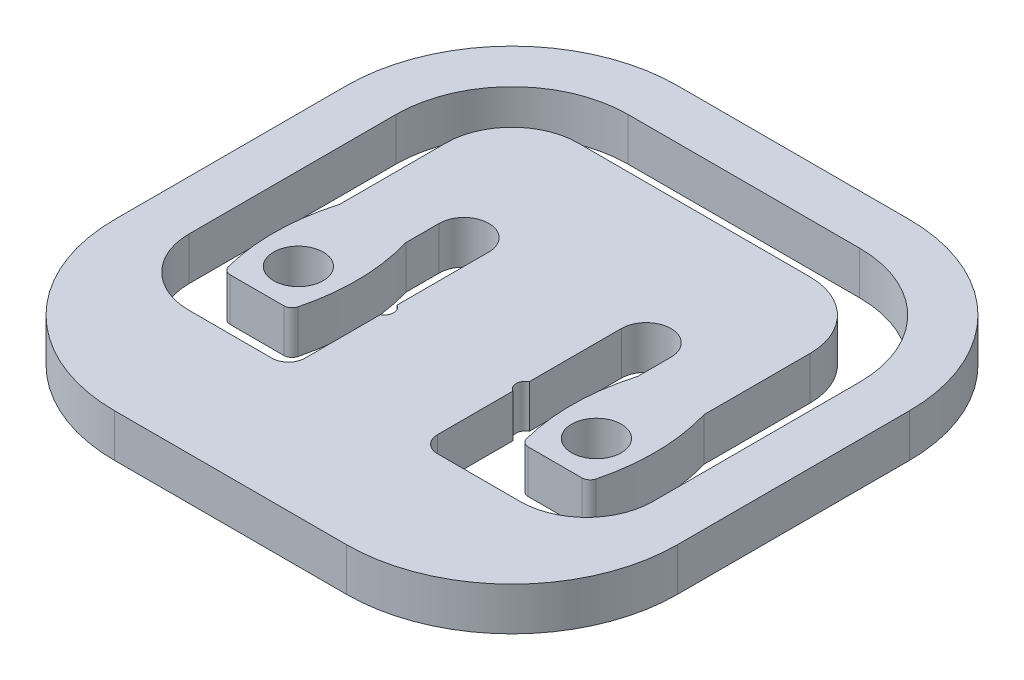
from build123d import *

# Parameters (mm, degrees)
SKETCH1_W                        = 34
SKETCH1_H                        = 34
BASE_DEPTH                       = 2.6
BASE_FILLET_R                    = 10
INNER_CUT_DEPTH                  = 25.181811347
INNER_LEFT_PROFILE_DEPTH         = 2.6
SKETCH5_R                        = 1.5
RIVET_HOLE_DEPTH                 = 25.181811347
GROOVED_PARTIAL_CIRCLE_CUT_DEPTH = 25.181811347
ILP_F_R                          = 0.5
IC_F_R                           = 1
ILP_F_OF_MIRROR_INNER_FEATURES_R = 0.5
IC_F_OF_MIRROR_INNER_FEATURES_R  = 1


with BuildPart() as part:
    # Sketch1 → BASE (new body)
    with BuildSketch(Plane(origin=(0, 0, 0), x_dir=(1, 0, 0), z_dir=(0, 1, 0))):
        Rectangle(SKETCH1_W, SKETCH1_H)
    extrude(amount=BASE_DEPTH)

    # BASE FILLET
    base_fillet_edges = [part.edges().sort_by_distance(p)[0] for p in [
        (17, 1.3, 17),
        (-17, 1.3, 17),
        (-17, 1.3, -17),
        (17, 1.3, -17),
    ]]
    fillet(base_fillet_edges, radius=BASE_FILLET_R)

    # Sketch3 → INNER CUT (cut, through all)
    with BuildSketch(Plane(origin=(0, 2.6, 0), x_dir=(1, 0, 0), z_dir=(0, 1, 0))):
        with BuildLine():
            Line((-10, -9.5), (10, -9.5))
            ThreePointArc((10, -9.5), (12.828427125, -8.328427125), (14, -5.5))
            Line((14, -5.5), (14, 7))
            ThreePointArc((14, 7), (11.949747468, 11.949747468), (7, 14))
            Line((7, 14), (-7, 14))
            ThreePointArc((-7, 14), (-11.949747468, 11.949747468), (-14, 7))
            Line((-14, 7), (-14, -5.5))
            ThreePointArc((-14, -5.5), (-12.828427125, -8.328427125), (-10, -9.5))
        make_face()
    extrude(amount=-INNER_CUT_DEPTH, mode=Mode.SUBTRACT)

    # Sketch4 → INNER LEFT PROFILE (add)
    with BuildSketch(Plane(origin=(0, 0, 0), x_dir=(1, 0, 0), z_dir=(0, 1, 0))):
        with BuildLine():
            Line((-4, 2.6), (-4, -9.5))
            Line((-4, -9.5), (0, -9.5))
            Line((0, -9.5), (0, 11))
            Line((0, 11), (-7, 11))
            ThreePointArc((-7, 11), (-9.828427125, 9.828427125), (-11, 7))
            Line((-11, 7), (-11, 0.6))
            ThreePointArc((-11, 0.6), (-11.5, -2.9), (-11, -6.4))
            Line((-11, -6.4), (-7, -6.4))
            ThreePointArc((-7, -6.4), (-6.5, -2.9), (-7, 0.6))
            Line((-7, 0.6), (-7, 2.6))
            ThreePointArc((-7, 2.6), (-5.5, 4.1), (-4, 2.6))
        make_face()
    inner_left_profile = extrude(amount=INNER_LEFT_PROFILE_DEPTH)

    # Sketch5 → RIVET HOLE (cut, through all)
    with BuildSketch(Plane(origin=(0, 2.6, 0), x_dir=(1, 0, 0), z_dir=(0, 1, 0))):
        with Locations(Location((-9, -3.9, 0), (0, 0, 270))):
            Circle(SKETCH5_R)
    rivet_hole = extrude(amount=-RIVET_HOLE_DEPTH, mode=Mode.SUBTRACT)

    # Sketch6 → GROOVED PARTIAL CIRCLE CUT (cut, through all)
    with BuildSketch(Plane(origin=(0, 2.6, 0), x_dir=(1, 0, 0), z_dir=(0, 1, 0))):
        with BuildLine():
            Line((-4, -2.95), (-4, -3.95))
            ThreePointArc((-4, -3.95), (-3.7, -3.45), (-4, -2.95))
        make_face()
    grooved_partial_circle_cut = extrude(amount=-GROOVED_PARTIAL_CIRCLE_CUT_DEPTH, mode=Mode.SUBTRACT)

    # ILP F
    ilp_f_edges = [part.edges().sort_by_distance(p)[0] for p in [
        (-11, 1.3, 6.4),
        (-7, 1.3, 6.4),
    ]]
    fillet(ilp_f_edges, radius=ILP_F_R)

    # IC F
    ic_f_edges = [part.edges().sort_by_distance(p)[0] for p in [
        (-4, 1.3, 9.5),
    ]]
    fillet(ic_f_edges, radius=IC_F_R)

    # MIRROR INNER FEATURES: INNER LEFT PROFILE, RIVET HOLE, GROOVED PARTIAL CIRCLE CUT across plane
    add(inner_left_profile.mirror(Plane(origin=(0, 0, 0), x_dir=(0, 0, 1), z_dir=(1, 0, 0))))
    add(rivet_hole.mirror(Plane(origin=(0, 0, 0), x_dir=(0, 0, 1), z_dir=(1, 0, 0))), mode=Mode.SUBTRACT)
    add(grooved_partial_circle_cut.mirror(Plane(origin=(0, 0, 0), x_dir=(0, 0, 1), z_dir=(1, 0, 0))), mode=Mode.SUBTRACT)

    # ILP F of MIRROR INNER FEATURES
    ilp_f_of_mirror_inner_features_edges = [part.edges().sort_by_distance(p)[0] for p in [
        (11, 1.3, 6.4),
        (7, 1.3, 6.4),
    ]]
    fillet(ilp_f_of_mirror_inner_features_edges, radius=ILP_F_OF_MIRROR_INNER_FEATURES_R)

    # IC F of MIRROR INNER FEATURES
    ic_f_of_mirror_inner_features_edges = [part.edges().sort_by_distance(p)[0] for p in [
        (4, 1.3, 9.5),
    ]]
    fillet(ic_f_of_mirror_inner_features_edges, radius=IC_F_OF_MIRROR_INNER_FEATURES_R)


solid = part.part
